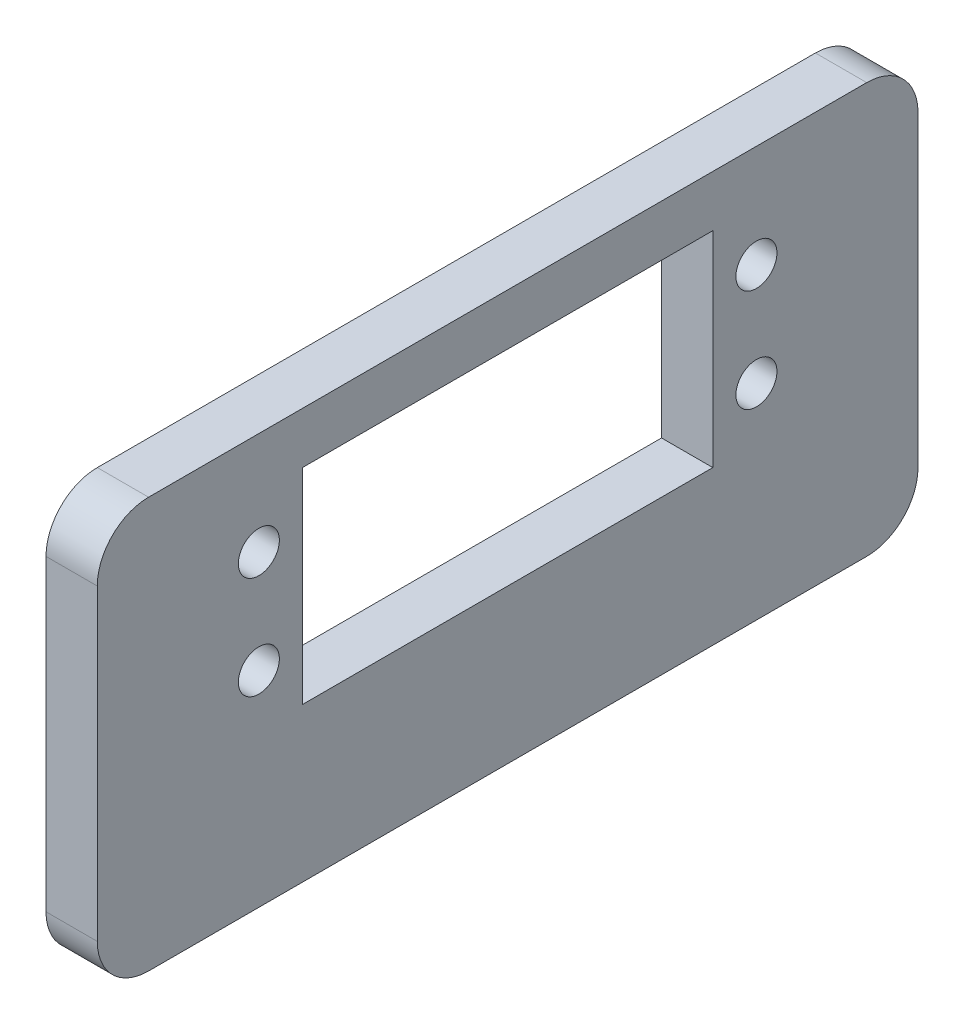
from build123d import *

# Parameters (mm, degrees)
SKETCH1_W           = 80
SKETCH1_H           = 40
SKETCH1_R           = 2
SKETCH1_W_2         = 40
SKETCH1_H_2         = 20
BOSS_EXTRUDE1_DEPTH = 5
FILLET1_R           = 5


with BuildPart() as part:
    # Sketch1 → Boss-Extrude1 (new body)
    with BuildSketch(Plane(origin=(0, 0, 0), x_dir=(0, 0, -1), z_dir=(1, 0, 0))):
        Rectangle(SKETCH1_W, SKETCH1_H)
        with Locations((24.25, 10)):
            Circle(SKETCH1_R, mode=Mode.SUBTRACT)
        with Locations((24.25, 0)):
            Circle(SKETCH1_R, mode=Mode.SUBTRACT)
        with Locations(Location((-24.25, 10, 0), (0, 0, 180))):
            Circle(SKETCH1_R, mode=Mode.SUBTRACT)
        with Locations(Location((-24.25, 0, 0), (0, 0, 180))):
            Circle(SKETCH1_R, mode=Mode.SUBTRACT)
        with Locations((0, 5)):
            Rectangle(SKETCH1_W_2, SKETCH1_H_2, mode=Mode.SUBTRACT)
    extrude(amount=BOSS_EXTRUDE1_DEPTH)

    # Fillet1
    fillet1_edges = [part.edges().sort_by_distance(p)[0] for p in [
        (2.5, 20, 40),
        (2.5, 20, -40),
        (2.5, -20, -40),
        (2.5, -20, 40),
    ]]
    fillet(fillet1_edges, radius=FILLET1_R)


solid = part.part
